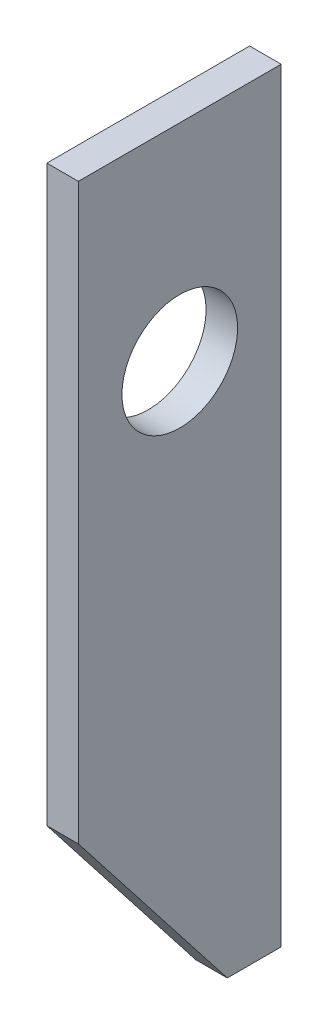
from build123d import *

# Parameters (mm, degrees)
EXTRUDE_1_DEPTH     = 3
SKETCH_2_R          = 5.5
CUT_EXTRUDE_1_DEPTH = 38.72513216


with BuildPart() as part:
    # Эскиз1 → Бобышка-Вытянуть1 (new body)
    with BuildSketch(Plane(origin=(0, 0, 0), x_dir=(0, 0, -1), z_dir=(1, 0, 0))):
        Polygon((9.642962643, 36.348299382), (-9.642962643, 36.348299382), (-9.642962643, -18.220164561), (4.520288528, -36.348299382), (9.642962643, -36.348299382), align=None)
    extrude(amount=EXTRUDE_1_DEPTH)

    # Эскиз2 → Вырез-Вытянуть1 (cut, through all)
    with BuildSketch(Plane.ZY):
        with Locations((0, 16.706183396)):
            Circle(SKETCH_2_R)
    extrude(amount=-CUT_EXTRUDE_1_DEPTH, mode=Mode.SUBTRACT)


solid = part.part
